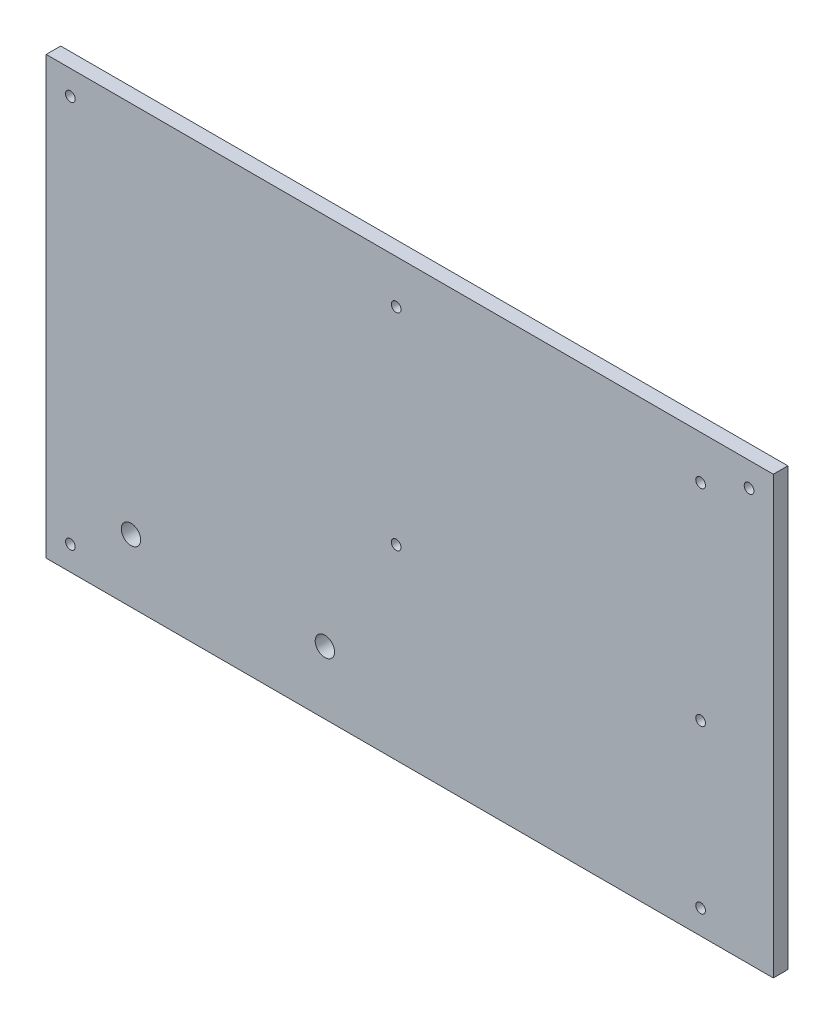
from build123d import *

# Parameters (mm, degrees)
ESBO_O1_W                = 300
ESBO_O1_H                = 180
ESBO_O1_R                = 2
ESBO_O1_R_2              = 4
RESSALTO_EXTRUS_O1_DEPTH = 6
ESBO_O2_R                = 2
CORTE_EXTRUS_O1_DEPTH    = 10


with BuildPart() as part:
    # Esboço1 → Ressalto-extrusão1 (new body)
    with BuildSketch(Plane.XY):
        Rectangle(ESBO_O1_W, ESBO_O1_H)
        with Locations((120, -80)):
            Circle(ESBO_O1_R, mode=Mode.SUBTRACT)
        with Locations((140, 80)):
            Circle(ESBO_O1_R, mode=Mode.SUBTRACT)
        with Locations((-140, 80)):
            Circle(ESBO_O1_R, mode=Mode.SUBTRACT)
        with Locations((-140, -80)):
            Circle(ESBO_O1_R, mode=Mode.SUBTRACT)
        with Locations((-115, -64)):
            Circle(ESBO_O1_R_2, mode=Mode.SUBTRACT)
        with Locations((-35, -64)):
            Circle(ESBO_O1_R_2, mode=Mode.SUBTRACT)
    extrude(amount=RESSALTO_EXTRUS_O1_DEPTH)

    # Esboço2 → Corte-extrusão1 (cut)
    with BuildSketch(Plane.XY.offset(6)):
        with Locations((120, 72)):
            Circle(ESBO_O2_R)
        with Locations((-5.6, 72)):
            Circle(ESBO_O2_R)
        with Locations((-5.6, -13)):
            Circle(ESBO_O2_R)
        with Locations((120, -13)):
            Circle(ESBO_O2_R)
    extrude(amount=-CORTE_EXTRUS_O1_DEPTH, mode=Mode.SUBTRACT)


solid = part.part
